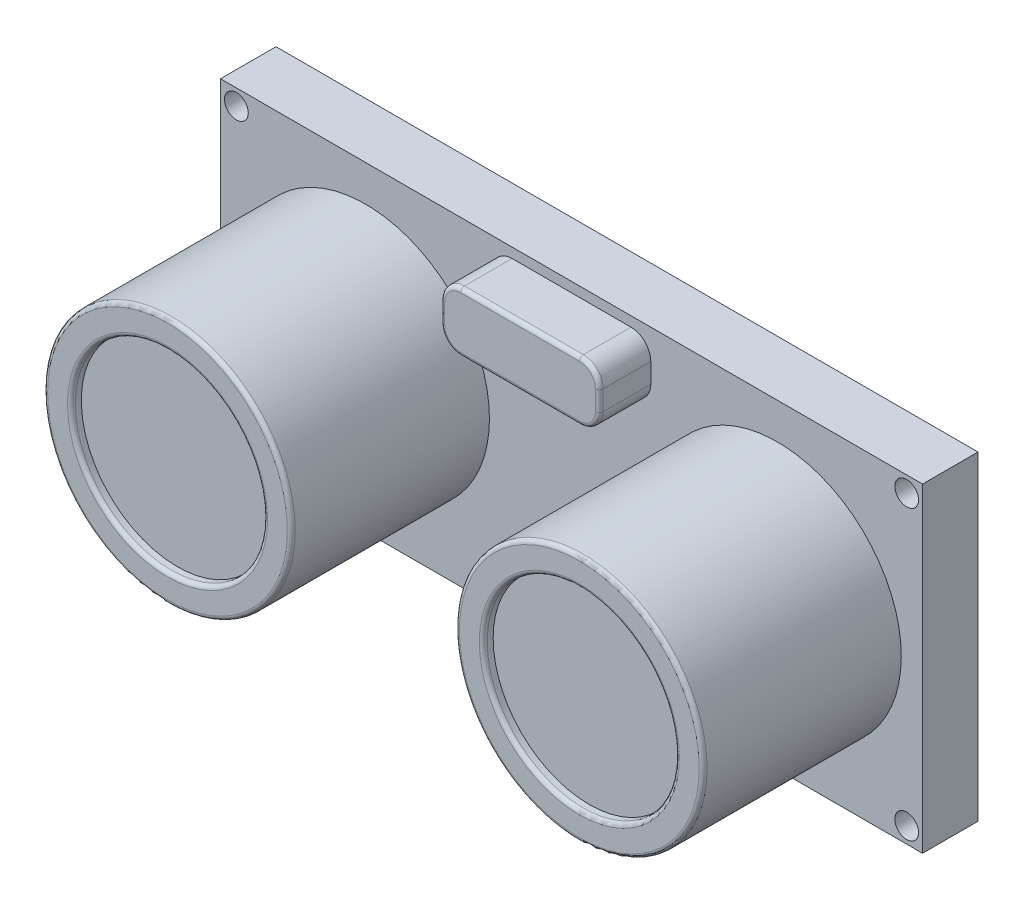
from build123d import *

# Parameters (mm, degrees)
SKETCH1_W           = 45
SKETCH1_H           = 20.5
BOSS_EXTRUDE2_DEPTH = 3.556
SKETCH2_R           = 7.9375
BOSS_EXTRUDE3_DEPTH = 12.7
SKETCH3_R           = 6.1595
CUT_EXTRUDE1_DEPTH  = 0.635
SKETCH4_W           = 10.16
SKETCH4_H           = 3.81
BOSS_EXTRUDE4_DEPTH = 3.302
FILLET1_R           = 1.27
FILLET2_R           = 0.254
SKETCH5_R           = 0.762
CUT_EXTRUDE2_DEPTH  = 3.302


with BuildPart() as part:
    # Sketch1 → Boss-Extrude2 (new body)
    with BuildSketch(Plane.XY):
        Rectangle(SKETCH1_W, SKETCH1_H)
    extrude(amount=BOSS_EXTRUDE2_DEPTH)

    # Sketch2 → Boss-Extrude3 (add)
    with BuildSketch(Plane.XY.offset(3.556)):
        with Locations((13.2, 0)):
            Circle(SKETCH2_R)
        with Locations((-13.2, 0)):
            Circle(SKETCH2_R)
    extrude(amount=BOSS_EXTRUDE3_DEPTH)

    # Sketch3 → Cut-Extrude1 (cut)
    with BuildSketch(Plane.XY.offset(16.256)):
        with Locations((-13.2, 0)):
            Circle(SKETCH3_R)
        with Locations((13.2, 0)):
            Circle(SKETCH3_R)
    extrude(amount=-CUT_EXTRUDE1_DEPTH, mode=Mode.SUBTRACT)

    # Sketch4 → Boss-Extrude4 (add)
    with BuildSketch(Plane.XY.offset(3.556)):
        with Locations((0, 7.71)):
            Rectangle(SKETCH4_W, SKETCH4_H)
    extrude(amount=BOSS_EXTRUDE4_DEPTH)

    # Fillet1
    fillet1_edges = [part.edges().sort_by_distance(p)[0] for p in [
        (5.08, 5.805, 5.207),
        (-5.08, 9.615, 5.207),
        (5.08, 9.615, 5.207),
        (-5.08, 5.805, 5.207),
    ]]
    fillet(fillet1_edges, radius=FILLET1_R)

    # Fillet2
    fillet2_edges = [part.edges().sort_by_distance(p)[0] for p in [
        (-4.708025612, 6.176974388, 6.858),
        (-5.08, 7.71, 6.858),
        (-4.708025612, 9.243025612, 6.858),
        (0, 9.615, 6.858),
        (4.708025612, 9.243025612, 6.858),
        (5.08, 7.71, 6.858),
        (4.708025612, 6.176974388, 6.858),
        (0, 5.805, 6.858),
        (5.2625, 0, 16.256),
        (7.0405, 0, 16.256),
        (-21.1375, 0, 16.256),
        (-19.3595, 0, 16.256),
    ]]
    fillet(fillet2_edges, radius=FILLET2_R)

    # Sketch5 → Cut-Extrude2 (cut)
    with BuildSketch(Plane.XY.offset(3.556)):
        with Locations((21.484, -9.234)):
            Circle(SKETCH5_R)
        with Locations((21.484, 9.234)):
            Circle(SKETCH5_R)
        with Locations((-21.484, 9.234)):
            Circle(SKETCH5_R)
        with Locations((-21.484, -9.234)):
            Circle(SKETCH5_R)
    extrude(amount=-CUT_EXTRUDE2_DEPTH, mode=Mode.SUBTRACT)


solid = part.part
